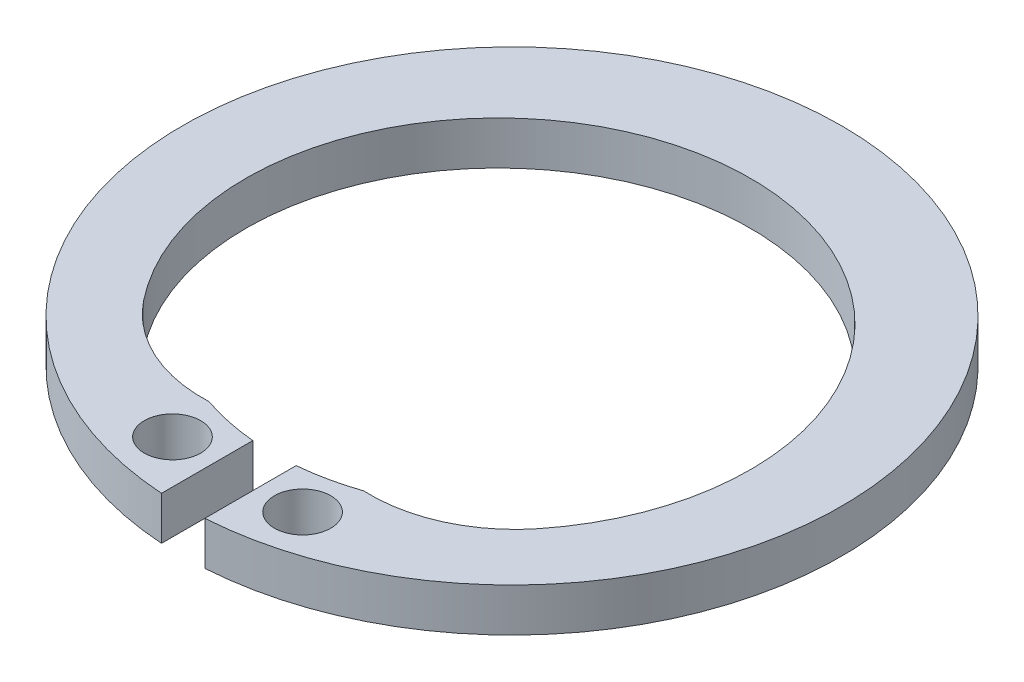
from build123d import *

# Parameters (mm, degrees)
SKETCH1_R           = 0.65
BOSS_EXTRUDE1_DEPTH = 1


with BuildPart() as part:
    # Sketch1 → Boss-Extrude1 (new body)
    with BuildSketch(Plane(origin=(0, 0, 0), x_dir=(1, 0, 0), z_dir=(0, 1, 0))):
        with BuildLine():
            Line((-0.5, -7.583534796), (-0.5, -5.477225575))
            ThreePointArc((-0.5, -5.477225575), (-1.148443874, -5.37876163), (-1.780556133, -5.203808207))
            ThreePointArc((-1.780556133, -5.203808207), (-3.318545169, -4.906574915), (-4.553408035, -3.94279506))
            ThreePointArc((-4.553408035, -3.94279506), (0, 5.5), (4.553408035, -3.94279506))
            ThreePointArc((4.553408035, -3.94279506), (3.318545169, -4.906574915), (1.780556133, -5.203808207))
            ThreePointArc((1.780556133, -5.203808207), (1.148443874, -5.37876163), (0.5, -5.477225575))
            Line((0.5, -5.477225575), (0.5, -7.583534796))
            ThreePointArc((0.5, -7.583534796), (0, 7.6), (-0.5, -7.583534796))
        make_face()
        with Locations((-1.5, -6.329588857)):
            Circle(SKETCH1_R, mode=Mode.SUBTRACT)
        with Locations((1.5, -6.329588857)):
            Circle(SKETCH1_R, mode=Mode.SUBTRACT)
    extrude(amount=BOSS_EXTRUDE1_DEPTH)


solid = part.part
